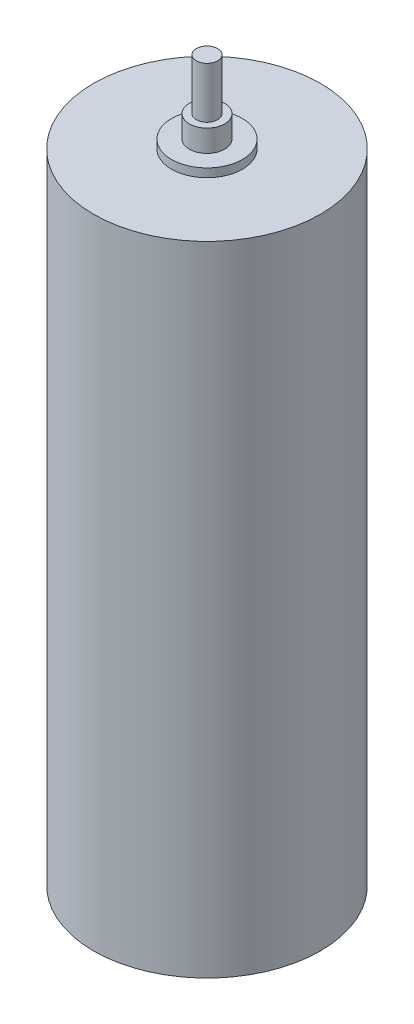
from build123d import *

# Parameters (mm, degrees)
SKETCH1_R           = 8
BOSS_EXTRUDE1_DEPTH = 45
SKETCH2_R           = 2.5
BOSS_EXTRUDE2_DEPTH = 0.6
SKETCH3_R           = 0.75
BOSS_EXTRUDE3_DEPTH = 5.75
SKETCH5_R           = 1.25
BOSS_EXTRUDE4_DEPTH = 2.15


with BuildPart() as part:
    # Sketch1 → Boss-Extrude1 (new body)
    with BuildSketch(Plane(origin=(0, 0, 0), x_dir=(1, 0, 0), z_dir=(0, 1, 0))):
        with Locations(Location((0, 0, 0), (0, 0, 270))):
            Circle(SKETCH1_R)
    extrude(amount=-BOSS_EXTRUDE1_DEPTH)

    # Sketch2 → Boss-Extrude2 (add)
    with BuildSketch(Plane(origin=(0, 0, 0), x_dir=(1, 0, 0), z_dir=(0, 1, 0))):
        with Locations(Location((0, 0, 0), (0, 0, 270))):
            Circle(SKETCH2_R)
    extrude(amount=BOSS_EXTRUDE2_DEPTH)

    # Sketch3 → Boss-Extrude3 (add)
    with BuildSketch(Plane(origin=(0, 0, 0), x_dir=(1, 0, 0), z_dir=(0, 1, 0))):
        with Locations(Location((0, 0, 0), (0, 0, 270))):
            Circle(SKETCH3_R)
    extrude(amount=BOSS_EXTRUDE3_DEPTH)

    # Sketch5 → Boss-Extrude4 (add)
    with BuildSketch(Plane(origin=(0, 0, 0), x_dir=(1, 0, 0), z_dir=(0, 1, 0))):
        with Locations(Location((0, 0, 0), (0, 0, 90))):
            Circle(SKETCH5_R)
    extrude(amount=BOSS_EXTRUDE4_DEPTH)


solid = part.part
